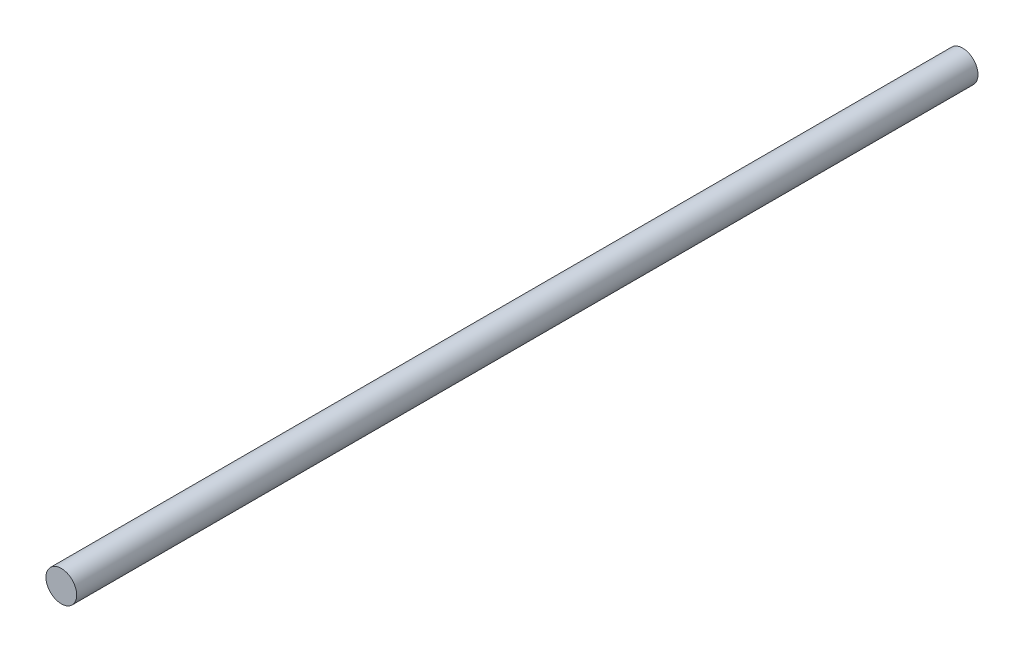
from build123d import *

# Parameters (mm, degrees)
SKETCH1_R           = 1.5
BOSS_EXTRUDE1_DEPTH = 88


with BuildPart() as part:
    # Sketch1 → Boss-Extrude1 (new body)
    with BuildSketch(Plane.XY):
        Circle(SKETCH1_R)
    extrude(amount=BOSS_EXTRUDE1_DEPTH)


solid = part.part
